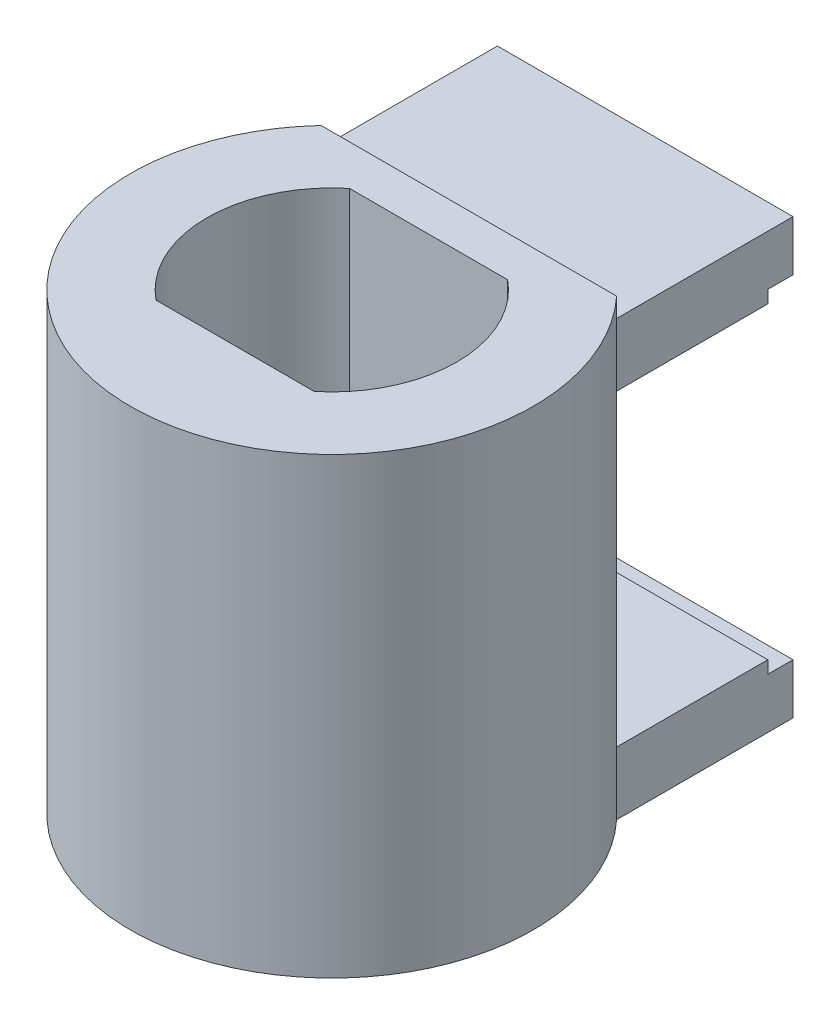
from build123d import *

# Parameters (mm, degrees)
SKETCH1_R               = 4.7625
SKETCH1_R_2             = 2.9718
BOSS_EXTRUDE1_DEPTH     = 6.35
SKETCH2_R               = 12.7
SKETCH2_R_2             = 2.9718
BOSS_EXTRUDE3_DEPTH     = 3.175
SKETCH3_R               = 12.7
BOSS_EXTRUDE4_DEPTH     = 19.05
CUT_EXTRUDE1_DEPTH      = 29.575
CUT_EXTRUDE1_DEPTH_BACK = 29.575
SKETCH4_R               = 1.143
SKETCH5_W               = 25.4
SKETCH5_H               = 28.575
CUT_EXTRUDE2_DEPTH      = 38.855587712
BOSS_EXTRUDE6_START     = 6.35
BOSS_EXTRUDE6_DEPTH     = 6.35
SKETCH8_W               = 18.623587624
SKETCH8_H               = 3.175
BOSS_EXTRUDE7_DEPTH     = 11.1125
SKETCH9_W               = 18.623587624
SKETCH9_H               = 0.79375
BOSS_EXTRUDE8_DEPTH     = 9.525


with BuildPart() as part:
    # Sketch1 → Boss-Extrude1 (new body)
    with BuildSketch(Plane(origin=(0, 0, 0), x_dir=(1, 0, 0), z_dir=(0, 1, 0))):
        with Locations(Location((0, 0, 0), (0, 0, 270))):
            Circle(SKETCH1_R)
        with Locations(Location((0, 0, 0), (0, 0, 270))):
            Circle(SKETCH1_R_2, mode=Mode.SUBTRACT)
    extrude(amount=BOSS_EXTRUDE1_DEPTH)

    # Sketch2 → Boss-Extrude3 (add)
    with BuildSketch(Plane(origin=(0, 6.35, 0), x_dir=(1, 0, 0), z_dir=(0, 1, 0))):
        with Locations(Location((0, 0, 0), (0, 0, 270))):
            Circle(SKETCH2_R)
        with Locations(Location((0, 0, 0), (0, 0, 270))):
            Circle(SKETCH2_R_2, mode=Mode.SUBTRACT)
    extrude(amount=BOSS_EXTRUDE3_DEPTH)

    # Sketch3 → Boss-Extrude4 (add)
    with BuildSketch(Plane(origin=(0, 9.525, 0), x_dir=(1, 0, 0), z_dir=(0, 1, 0))):
        with Locations(Location((0, 0, 0), (0, 0, 270))):
            Circle(SKETCH3_R)
        with BuildLine():
            Line((-4.983839885, 6.096), (4.983839885, 6.096))
            ThreePointArc((4.983839885, 6.096), (7.874, 0), (4.983839885, -6.096))
            Line((4.983839885, -6.096), (-4.983839885, -6.096))
            ThreePointArc((-4.983839885, -6.096), (-7.874, 0), (-4.983839885, 6.096))
        make_face(mode=Mode.SUBTRACT)
    extrude(amount=BOSS_EXTRUDE4_DEPTH)

    # Sketch4 → Cut-Extrude1 (cut, two sides: drawn at the far end of the back side and taken through both)
    with BuildSketch(Plane.XZ.offset(-6.35).offset(-CUT_EXTRUDE1_DEPTH_BACK)):
        with Locations(Location((-4.399409051, -0.635, 0), (0, 0, 269.056983799))):
            Circle(SKETCH4_R)
        with Locations(Location((4.399409051, 0.635, 0), (0, 0, 287.369437604))):
            Circle(SKETCH4_R)
    extrude(amount=CUT_EXTRUDE1_DEPTH + CUT_EXTRUDE1_DEPTH_BACK, mode=Mode.SUBTRACT)

    # Sketch5 → Cut-Extrude2 (cut, through all)
    with BuildSketch(Plane.XY.offset(-8.636)):
        with Locations((0, 14.2875)):
            Rectangle(SKETCH5_W, SKETCH5_H)
    extrude(amount=-CUT_EXTRUDE2_DEPTH, mode=Mode.SUBTRACT)

    # Sketch7 → Boss-Extrude6 (add)
    with BuildSketch(Plane.XZ.offset(-6.35).offset(BOSS_EXTRUDE6_START)):
        with BuildLine():
            Line((-9.311793812, -8.636), (9.311793812, -8.636))
            ThreePointArc((9.311793812, -8.636), (0, 12.7), (-9.311793812, -8.636))
        make_face()
        with BuildLine():
            ThreePointArc((-4.740630835, 0.455878863), (-5.530685664, -0.798285714), (-4.418220539, -1.77784519))
            ThreePointArc((-4.418220539, -1.77784519), (0.680357143, -4.713652555), (4.740630835, -0.455878863))
            ThreePointArc((4.740630835, -0.455878863), (5.530685664, 0.798285714), (4.418220539, 1.77784519))
            ThreePointArc((4.418220539, 1.77784519), (-0.680357143, 4.713652555), (-4.740630835, 0.455878863))
        make_face(mode=Mode.SUBTRACT)
    extrude(amount=-BOSS_EXTRUDE6_DEPTH)

    # Sketch8 → Boss-Extrude7 (add)
    with BuildSketch(Plane(origin=(0, 0, -8.636), x_dir=(-1, 0, 0), z_dir=(0, 0, -1))):
        with Locations((0, 1.5875)):
            Rectangle(SKETCH8_W, SKETCH8_H)
        with Locations((0, 25.7683)):
            Rectangle(SKETCH8_W, SKETCH8_H)
    extrude(amount=BOSS_EXTRUDE7_DEPTH)

    # Sketch9 → Boss-Extrude8 (add)
    with BuildSketch(Plane(origin=(0, 0, -8.636), x_dir=(-1, 0, 0), z_dir=(0, 0, -1))):
        with Locations((0, 3.571875)):
            Rectangle(SKETCH9_W, SKETCH9_H)
        with Locations((0, 23.783925)):
            Rectangle(SKETCH9_W, SKETCH9_H)
    extrude(amount=BOSS_EXTRUDE8_DEPTH)


solid = part.part
